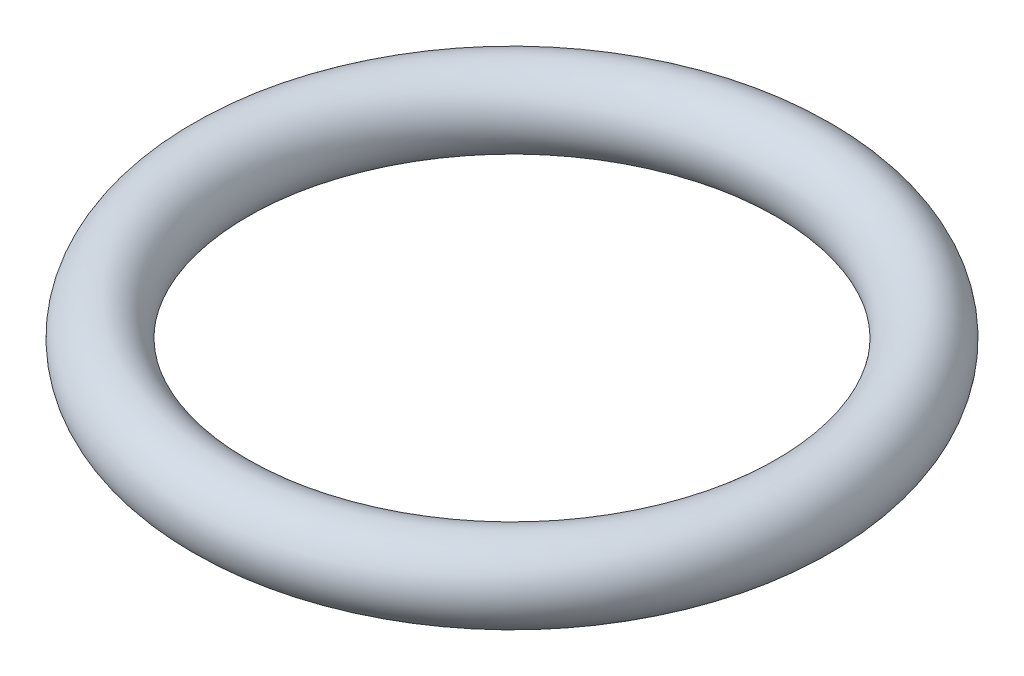
from build123d import *

# Parameters (mm, degrees)
IZIM1_R = 1.765


with BuildPart() as part:
    # Çizim1 → Döndür1 (revolve)
    with BuildSketch(Plane.XY, mode=Mode.PRIVATE) as d_nd_r1_sk:
        with Locations((-13.465, 0)):
            Circle(IZIM1_R)
    revolve(d_nd_r1_sk.sketch.rotate(Axis((0, 0, 0), (0, 1, 0)), 270), axis=Axis((0, 0, 0), (0, 1, 0)))


solid = part.part
